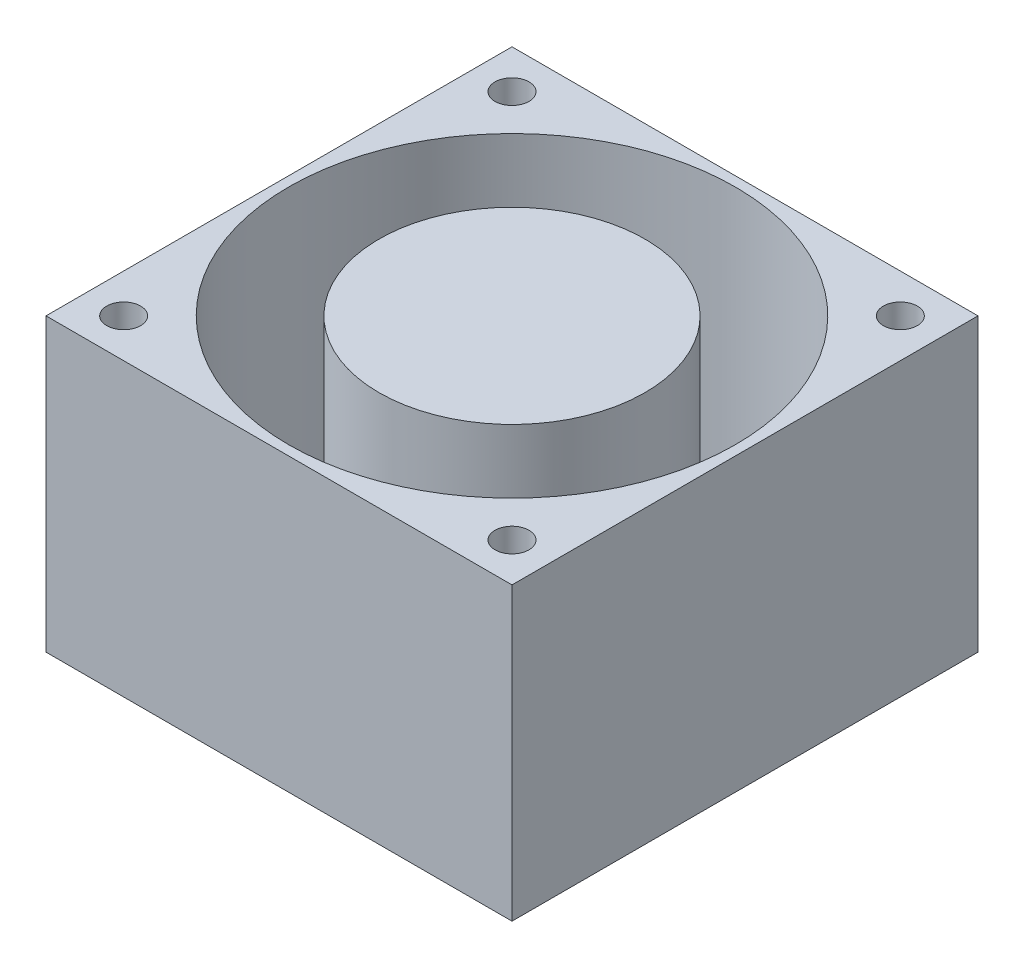
from build123d import *

# Parameters (mm, degrees)
SKETCH1_R             = 17.399
BOSS_EXTRUDE1_DEPTH   = 38.1
SKETCH1_R_2           = 29.21
SKETCH1_R_3           = 2.2225
BOSS_EXTRUDE1_2_DEPTH = 38.1
BOSS_EXTRUDE2_DEPTH   = 2.54


with BuildPart() as part:
    # Sketch1 → Boss-Extrude1 (new body)
    with BuildSketch(Plane(origin=(0, 0, 0), x_dir=(1, 0, 0), z_dir=(0, 1, 0))):
        with Locations(Location((0, 0, 0), (0, 0, 90))):
            Circle(SKETCH1_R)
    extrude(amount=BOSS_EXTRUDE1_DEPTH)



with BuildPart() as body_2:
    # Sketch1 → Boss-Extrude1 2 (new body)
    with BuildSketch(Plane(origin=(0, 0, 0), x_dir=(1, 0, 0), z_dir=(0, 1, 0))):
        Polygon((0, -30.48), (30.48, -30.48), (30.48, 30.48), (-30.48, 30.48), (-30.48, -30.48), align=None)
        with Locations(Location((0, 0, 0), (0, 0, 90))):
            Circle(SKETCH1_R_2, mode=Mode.SUBTRACT)
        with Locations(Location((-25.4, 25.4, 0), (0, 0, 90))):
            Circle(SKETCH1_R_3, mode=Mode.SUBTRACT)
        with Locations(Location((-25.4, -25.4, 0), (0, 0, 90))):
            Circle(SKETCH1_R_3, mode=Mode.SUBTRACT)
        with Locations(Location((25.4, -25.4, 0), (0, 0, 90))):
            Circle(SKETCH1_R_3, mode=Mode.SUBTRACT)
        with Locations(Location((25.4, 25.4, 0), (0, 0, 90))):
            Circle(SKETCH1_R_3, mode=Mode.SUBTRACT)
    extrude(amount=BOSS_EXTRUDE1_2_DEPTH)


with BuildPart() as part_1:
    add(part.part)

    add(body_2.part)  # Boss-Extrude2 merges body 2
    # Sketch2 → Boss-Extrude2 (add)
    with BuildSketch(Plane.XZ):
        with BuildLine():
            Line((-10.626679764, 28.595751034), (-6.570086281, 16.110840054))
            ThreePointArc((-6.570086281, 16.110840054), (-5.376586685, 16.547432327), (-4.15440273, 16.89574322))
            Line((-4.15440273, 16.89574322), (-8.210996213, 29.3806542))
            Line((-8.210996213, 29.3806542), (-10.626679764, 28.595751034))
        make_face()
        with BuildLine():
            Line((23.912350718, 18.943146073), (13.292051101, 11.227046741))
            ThreePointArc((13.292051101, 11.227046741), (14.076086685, 10.226875605), (14.785025642, 9.172143575))
            Line((14.785025642, 9.172143575), (25.405325259, 16.888242907))
            Line((25.405325259, 16.888242907), (23.912350718, 18.943146073))
        make_face()
        with BuildLine():
            ThreePointArc((14.785025642, -9.172143575), (14.076086685, -10.226875605), (13.292051101, -11.227046741))
            Line((13.292051101, -11.227046741), (23.912350718, -18.943146073))
            Line((23.912350718, -18.943146073), (25.405325259, -16.888242907))
            Line((25.405325259, -16.888242907), (14.785025642, -9.172143575))
        make_face()
        with BuildLine():
            ThreePointArc((-4.15440273, -16.89574322), (-5.376586685, -16.547432327), (-6.570086281, -16.110840054))
            Line((-6.570086281, -16.110840054), (-10.626679764, -28.595751034))
            Line((-10.626679764, -28.595751034), (-8.210996213, -29.3806542))
            Line((-8.210996213, -29.3806542), (-4.15440273, -16.89574322))
        make_face()
        with BuildLine():
            ThreePointArc((-17.352587732, -1.27), (-17.387393062, -0.635423894), (-17.399, 0))
            Line((-17.399, 0), (-30.48, 0))
            Line((-30.48, 0), (-30.48, -1.27))
            Line((-30.48, -1.27), (-17.352587732, -1.27))
        make_face()
        with BuildLine():
            Line((-30.48, 0), (-17.399, 0))
            ThreePointArc((-17.399, 0), (-17.387393062, 0.635423894), (-17.352587732, 1.27))
            Line((-17.352587732, 1.27), (-30.48, 1.27))
            Line((-30.48, 1.27), (-30.48, 0))
        make_face()
    extrude(amount=-BOSS_EXTRUDE2_DEPTH)


solid = part_1.part
